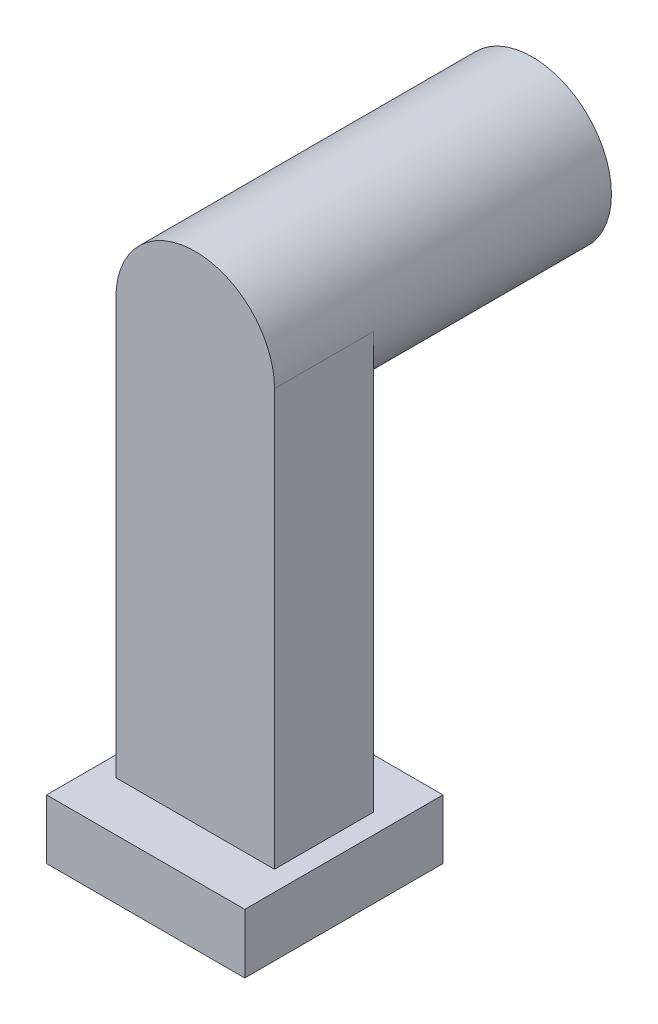
from build123d import *

# Parameters (mm, degrees)
BOSS_EXTRUDE1_START = 13
SKETCH1_R           = 1.9
BOSS_EXTRUDE1_DEPTH = 0.0001
BOSS_EXTRUDE2_START = 13
SKETCH2_R           = 4
BOSS_EXTRUDE2_DEPTH = 17
SKETCH6_W           = 8
SKETCH6_H           = 5
BOSS_EXTRUDE3_DEPTH = 21
SKETCH7_W           = 10
SKETCH7_H           = 10
BOSS_EXTRUDE4_DEPTH = 3


with BuildPart() as part:
    # Sketch1 → Boss-Extrude1 (new body)
    with BuildSketch(Plane.XY.offset(BOSS_EXTRUDE1_START)):
        Circle(SKETCH1_R)
    extrude(amount=BOSS_EXTRUDE1_DEPTH)

    # Sketch2 → Boss-Extrude2 (add)
    with BuildSketch(Plane.XY.offset(BOSS_EXTRUDE2_START)):
        Circle(SKETCH2_R)
    extrude(amount=BOSS_EXTRUDE2_DEPTH)

    # Sketch6 → Boss-Extrude3 (add)
    with BuildSketch(Plane(origin=(0, 0, 0), x_dir=(1, 0, 0), z_dir=(0, 1, 0))):
        with Locations((0, -27.5)):
            Rectangle(SKETCH6_W, SKETCH6_H)
    extrude(amount=-BOSS_EXTRUDE3_DEPTH)

    # Sketch7 → Boss-Extrude4 (add)
    with BuildSketch(Plane.XZ.offset(21)):
        with Locations((0, 27.5)):
            Rectangle(SKETCH7_W, SKETCH7_H)
    extrude(amount=BOSS_EXTRUDE4_DEPTH)


solid = part.part
